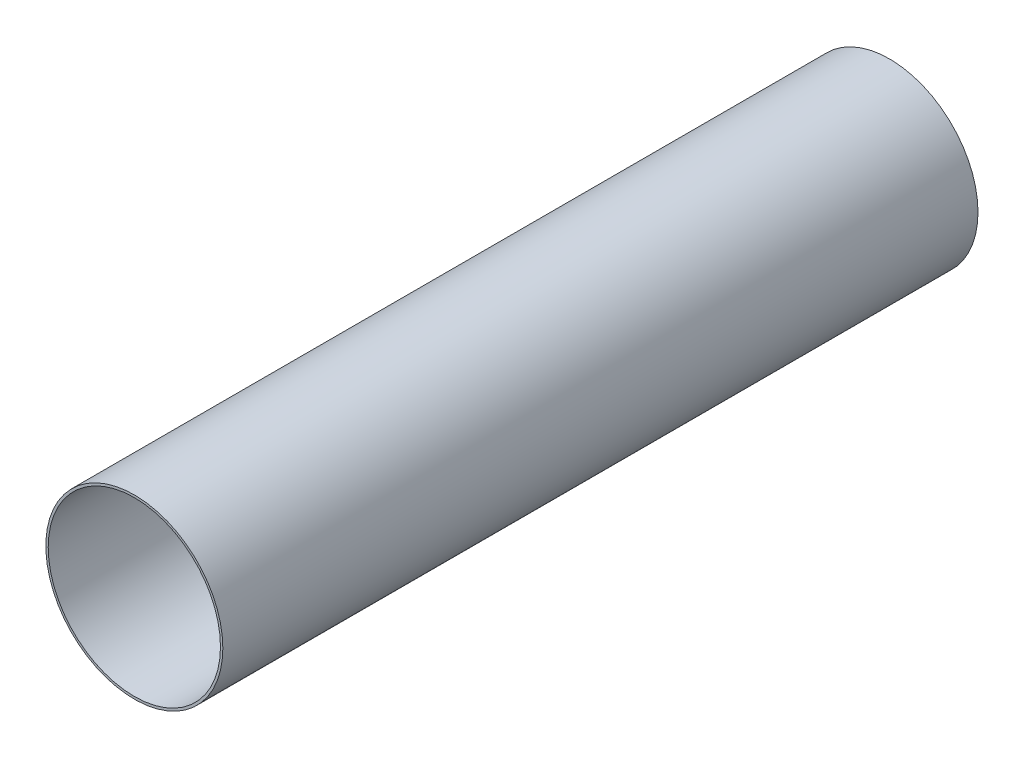
from build123d import *

# Parameters (mm, degrees)
SCHIZZO1_R                = 75
SCHIZZO1_R_2              = 73
ESTRUSIONE_SOTTILE1_DEPTH = 640


with BuildPart() as part:
    # Schizzo1 → Estrusione-Sottile1 (new body)
    with BuildSketch(Plane.XY):
        Circle(SCHIZZO1_R)
        Circle(SCHIZZO1_R_2, mode=Mode.SUBTRACT)
    extrude(amount=ESTRUSIONE_SOTTILE1_DEPTH)


solid = part.part
